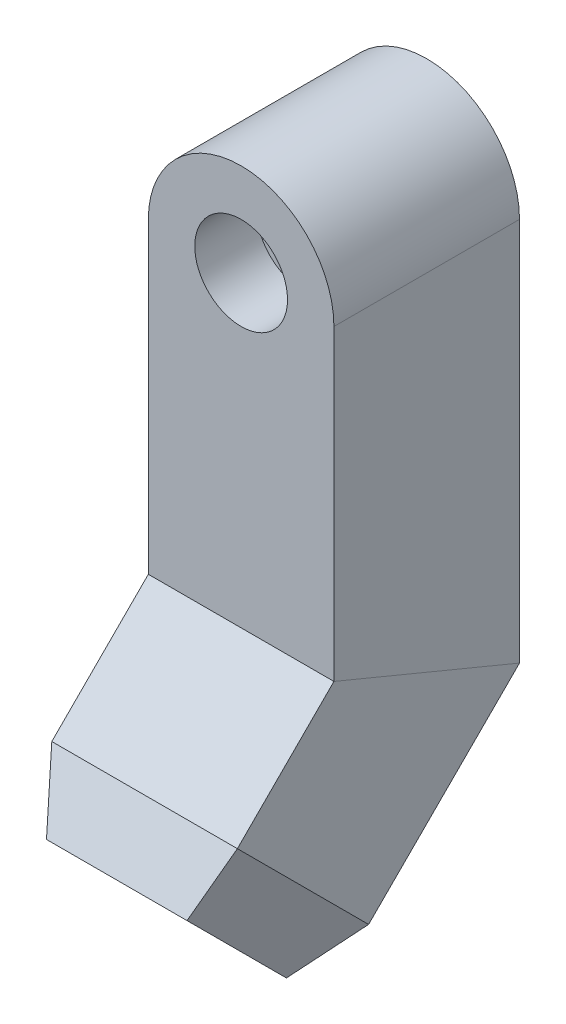
from build123d import *

# Parameters (mm, degrees)
SKETCH11_W          = 38.1
SKETCH11_H          = 38.1
SKETCH12_W          = 38.1
SKETCH12_H          = 38.1
BOSS_EXTRUDE5_DEPTH = 12.7
BOSS_EXTRUDE5_TAPER = 20
BOSS_EXTRUDE6_DEPTH = 38.1
SKETCH14_R          = 9.525
CUT_EXTRUDE2_DEPTH  = 12.7
SKETCH15_R          = 9.525
CUT_EXTRUDE3_DEPTH  = 12.7


with BuildPart() as part:
    # Sweep1: sweep along a path in Sketch10
    with BuildLine(Plane(origin=(0, 0, 0), x_dir=(0, 0, -1), z_dir=(1, 0, 0))) as sweep1_path:
        Line((0, 96.393), (0, 25.4))
        Line((0, 25.4), (-25.4, 0))
    # Sketch11 → Sweep1 (sweep)
    with BuildSketch(Plane(origin=(0, 96.393, 0), x_dir=(1, 0, 0), z_dir=(0, 1, 0))):
        Rectangle(SKETCH11_W, SKETCH11_H)
    sweep(path=sweep1_path.line, transition=Transition.RIGHT)

    # Sketch12 → Boss-Extrude5 (add)
    with BuildSketch(Plane(origin=(0, -12.7, 12.7), x_dir=(1, 0, 0), z_dir=(0, -0.7071067811865461, 0.7071067811865489))):
        with Locations((0, 17.960512242)):
            Rectangle(SKETCH12_W, SKETCH12_H)
    extrude(amount=BOSS_EXTRUDE5_DEPTH, taper=BOSS_EXTRUDE5_TAPER)

    # Sketch13 → Boss-Extrude6 (add)
    with BuildSketch(Plane(origin=(0, 0, -19.05), x_dir=(-1, 0, 0), z_dir=(0, 0, -1))):
        with BuildLine():
            Line((-19.05, 96.393), (19.05, 96.393))
            ThreePointArc((19.05, 96.393), (0, 115.443), (-19.05, 96.393))
        make_face()
    extrude(amount=-BOSS_EXTRUDE6_DEPTH)

    # Sketch14 → Cut-Extrude2 (cut)
    with BuildSketch(Plane.XY.offset(19.05)):
        with Locations((0, 96.393)):
            Circle(SKETCH14_R)
    extrude(amount=-CUT_EXTRUDE2_DEPTH, mode=Mode.SUBTRACT)

    # Sketch15 → Cut-Extrude3 (cut)
    with BuildSketch(Plane(origin=(0, -21.680256121, 21.680256121), x_dir=(1, 0, 0), z_dir=(0, -0.7071067811865461, 0.7071067811865489))):
        with Locations(Location((0, 17.960512242, 0), (0, 0, 270))):
            Circle(SKETCH15_R)
    extrude(amount=-CUT_EXTRUDE3_DEPTH, mode=Mode.SUBTRACT)


solid = part.part
